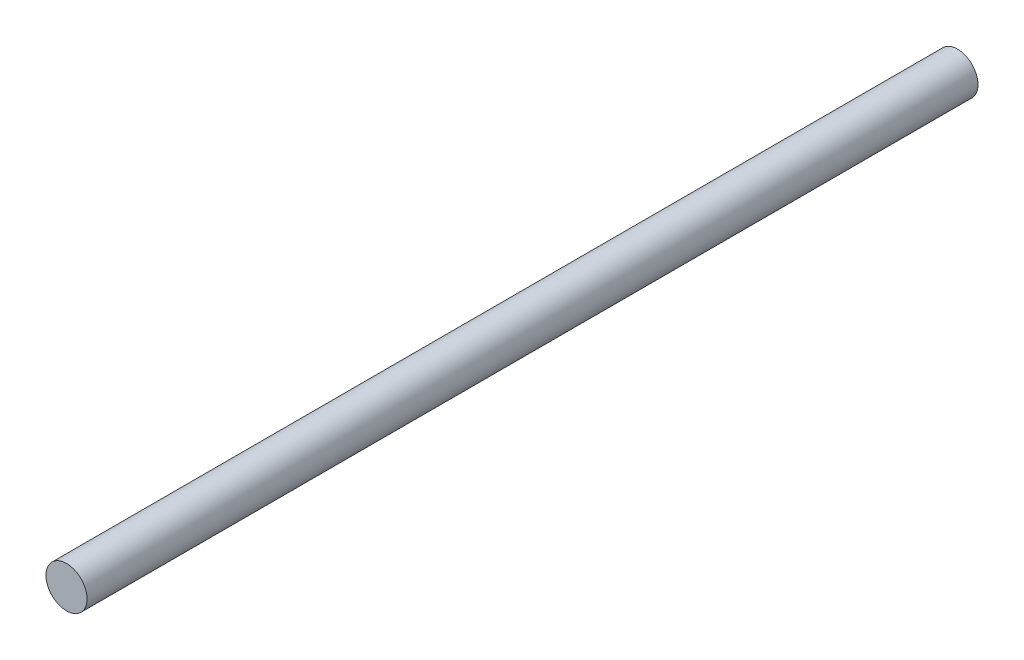
from build123d import *

# Parameters (mm, degrees)
SKETCH1_R           = 2.375
BOSS_EXTRUDE1_DEPTH = 103


with BuildPart() as part:
    # Sketch1 → Boss-Extrude1 (new body)
    with BuildSketch(Plane.XY):
        Circle(SKETCH1_R)
    extrude(amount=BOSS_EXTRUDE1_DEPTH)


solid = part.part
